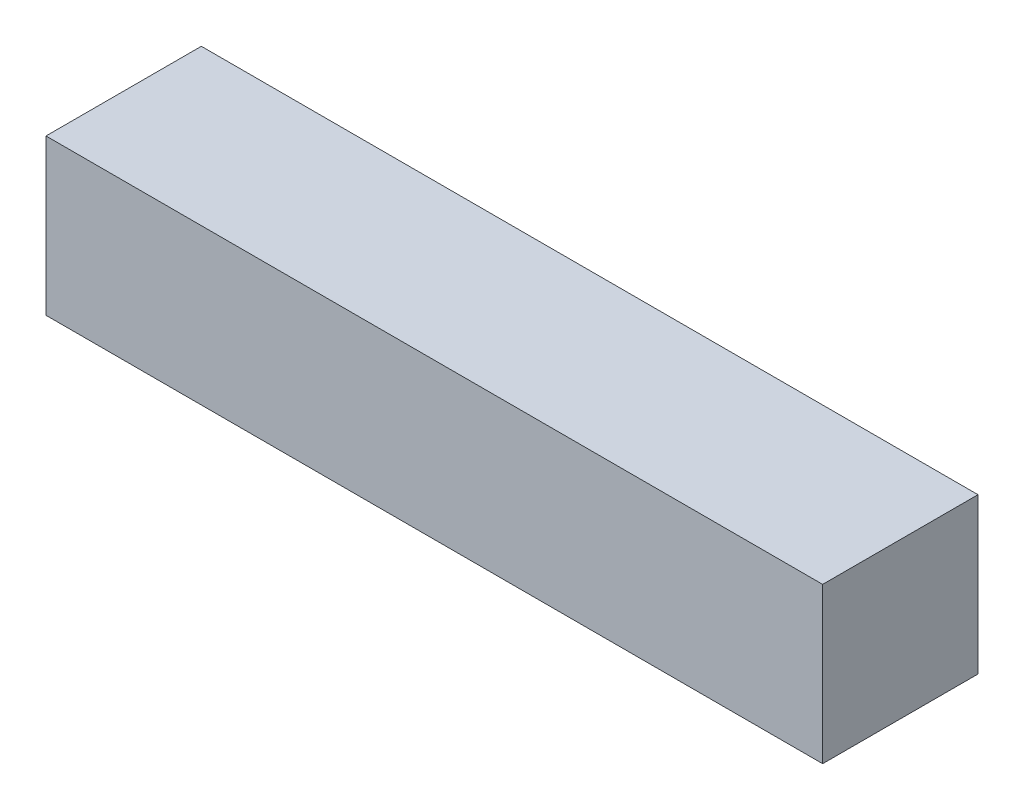
from build123d import *

# Parameters (mm, degrees)
SKETCH1_W           = 6
SKETCH1_H           = 30
BOSS_EXTRUDE1_DEPTH = 6


with BuildPart() as part:
    # Sketch1 → Boss-Extrude1 (new body)
    with BuildSketch(Plane(origin=(0, 0, 0), x_dir=(0, 1, 0), z_dir=(0, 0, 1))):
        with Locations((-3, 3.073170732)):
            Rectangle(SKETCH1_W, SKETCH1_H)
    extrude(amount=BOSS_EXTRUDE1_DEPTH)


solid = part.part
